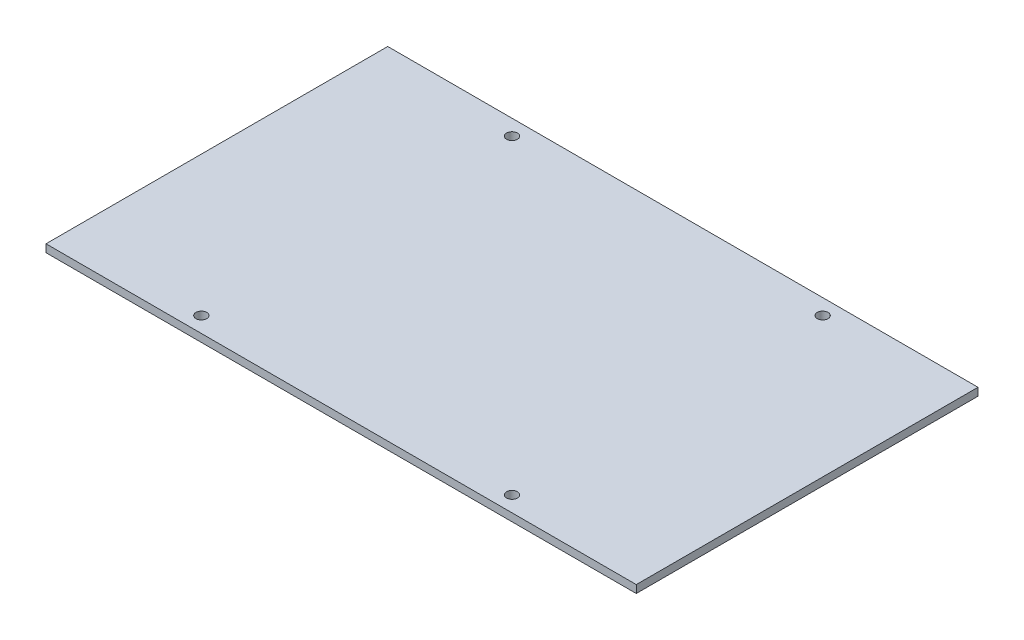
from build123d import *

# Parameters (mm, degrees)
SKETCH1_W               = 380
SKETCH1_H               = 220
BOSS_EXTRUDE1_DEPTH     = 2.5
SKETCH4_R               = 3.5
CUT_EXTRUDE1_DEPTH      = 5
MIRROR4_COPY_1_SKETCH_R = 3.5
MIRROR4_COPY_1_DEPTH    = 5


with BuildPart() as part:
    # Sketch1 → Boss-Extrude1 (new, symmetric)
    with BuildSketch(Plane(origin=(0, 0, 0), x_dir=(1, 0, 0), z_dir=(0, 1, 0))):
        Rectangle(SKETCH1_W, SKETCH1_H)
    extrude(amount=BOSS_EXTRUDE1_DEPTH, both=True)

    # Sketch4 → Cut-Extrude1 (cut)
    with BuildSketch(Plane(origin=(0, 2.5, 0), x_dir=(1, 0, 0), z_dir=(0, 1, 0))):
        with Locations(Location((-100, 100, 0), (0, 0, 270))):
            Circle(SKETCH4_R)
    cut_extrude1 = extrude(amount=-CUT_EXTRUDE1_DEPTH, mode=Mode.SUBTRACT)

    # Mirror3: Cut-Extrude1 across plane
    add(cut_extrude1.mirror(Plane(origin=(0, 0, 0), x_dir=(0, 0, 1), z_dir=(1, 0, 0))), mode=Mode.SUBTRACT)

    # Mirror4: Cut-Extrude1 across plane
    add(cut_extrude1.mirror(Plane.XY), mode=Mode.SUBTRACT)

    # Mirror4 copy 1 sketch → Mirror4 copy 1 (cut)
    with BuildSketch(Plane(origin=(0, 2.5, 0), x_dir=(-1, 0, 0), z_dir=(0, 1, 0))):
        with Locations(Location((-100, 100, 0), (0, 0, 270))):
            Circle(MIRROR4_COPY_1_SKETCH_R)
    extrude(amount=-MIRROR4_COPY_1_DEPTH, mode=Mode.SUBTRACT)


solid = part.part
